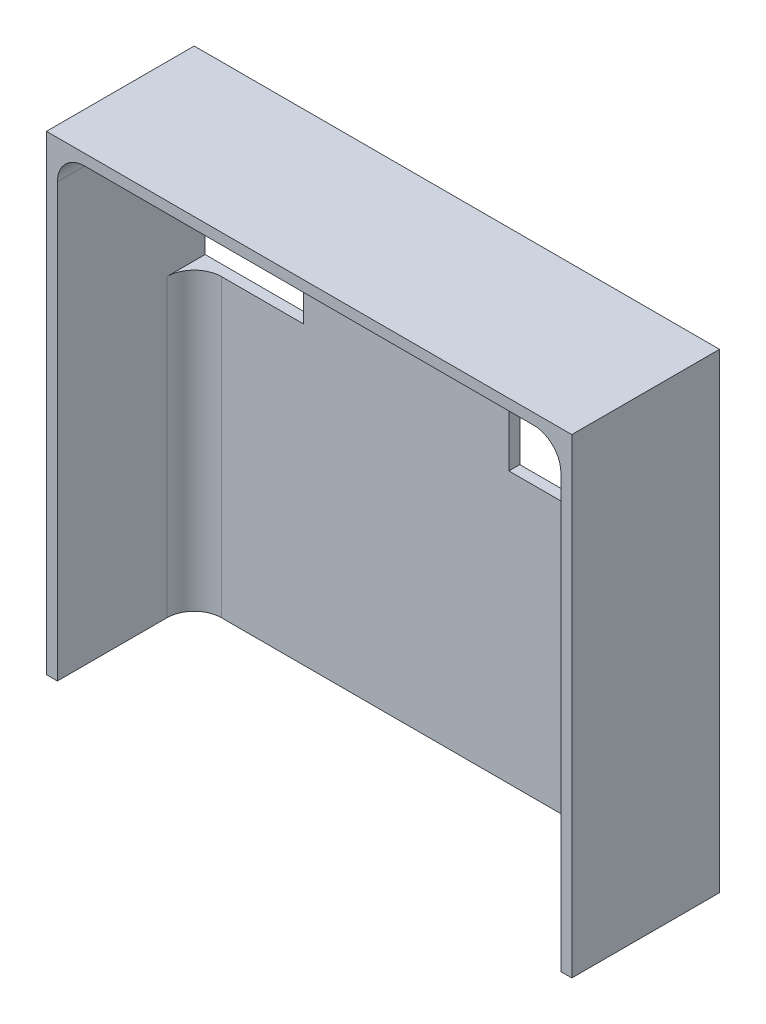
from build123d import *

# Parameters (mm, degrees)
SKETCH1_W           = 96
SKETCH1_H           = 86
BOSS_EXTRUDE1_DEPTH = 2
BOSS_EXTRUDE3_DEPTH = 25
SKETCH3_W           = 20
SKETCH3_H           = 30
CUT_EXTRUDE1_DEPTH  = 25
SKETCH4_W           = 14.5
SKETCH4_H           = 14.5
CUT_EXTRUDE2_DEPTH  = 25
SKETCH5_W           = 13
SKETCH5_H           = 13
CUT_EXTRUDE3_DEPTH  = 25
FILLET1_R           = 5


with BuildPart() as part:
    # Sketch1 → Boss-Extrude1 (new body)
    with BuildSketch(Plane.XY):
        with Locations((-344.5, 129.5)):
            Rectangle(SKETCH1_W, SKETCH1_H)
    extrude(amount=BOSS_EXTRUDE1_DEPTH)

    # Sketch2 → Boss-Extrude3 (add)
    with BuildSketch(Plane.XY.offset(2)):
        Polygon((-296.5, 170.5), (-296.5, 172.5), (-298.5, 172.5), (-390.5, 172.5), (-392.5, 172.5), (-392.5, 170.5), (-392.5, 86.5), (-390.5, 86.5), (-390.5, 170.5), (-298.5, 170.5), (-298.5, 86.5), (-296.5, 86.5), align=None)
    extrude(amount=BOSS_EXTRUDE3_DEPTH)

    # Sketch3 → Cut-Extrude1 (cut)
    with BuildSketch(Plane(origin=(0, 0, 0), x_dir=(-1, 0, 0), z_dir=(0, 0, -1))):
        with Locations((380.5, 155.5)):
            Rectangle(SKETCH3_W, SKETCH3_H)
    extrude(amount=-CUT_EXTRUDE1_DEPTH, mode=Mode.SUBTRACT)

    # Sketch4 → Cut-Extrude2 (cut)
    with BuildSketch(Plane(origin=(0, 0, 0), x_dir=(-1, 0, 0), z_dir=(0, 0, -1))):
        with Locations((325.75, 143.25)):
            Rectangle(SKETCH4_W, SKETCH4_H)
    extrude(amount=-CUT_EXTRUDE2_DEPTH, mode=Mode.SUBTRACT)

    # Sketch5 → Cut-Extrude3 (cut)
    with BuildSketch(Plane(origin=(0, 0, 0), x_dir=(-1, 0, 0), z_dir=(0, 0, -1))):
        with Locations((313, 111)):
            Rectangle(SKETCH5_W, SKETCH5_H)
    extrude(amount=-CUT_EXTRUDE3_DEPTH, mode=Mode.SUBTRACT)

    # Fillet1
    fillet1_edges = [part.edges().sort_by_distance(p)[0] for p in [
        (-390.5, 170.5, 13.5),
        (-298.5, 128.5, 2),
        (-298.5, 170.5, 14.5),
        (-334.5, 170.5, 2),
        (-390.5, 113.5, 2),
    ]]
    fillet(fillet1_edges, radius=FILLET1_R)


solid = part.part
